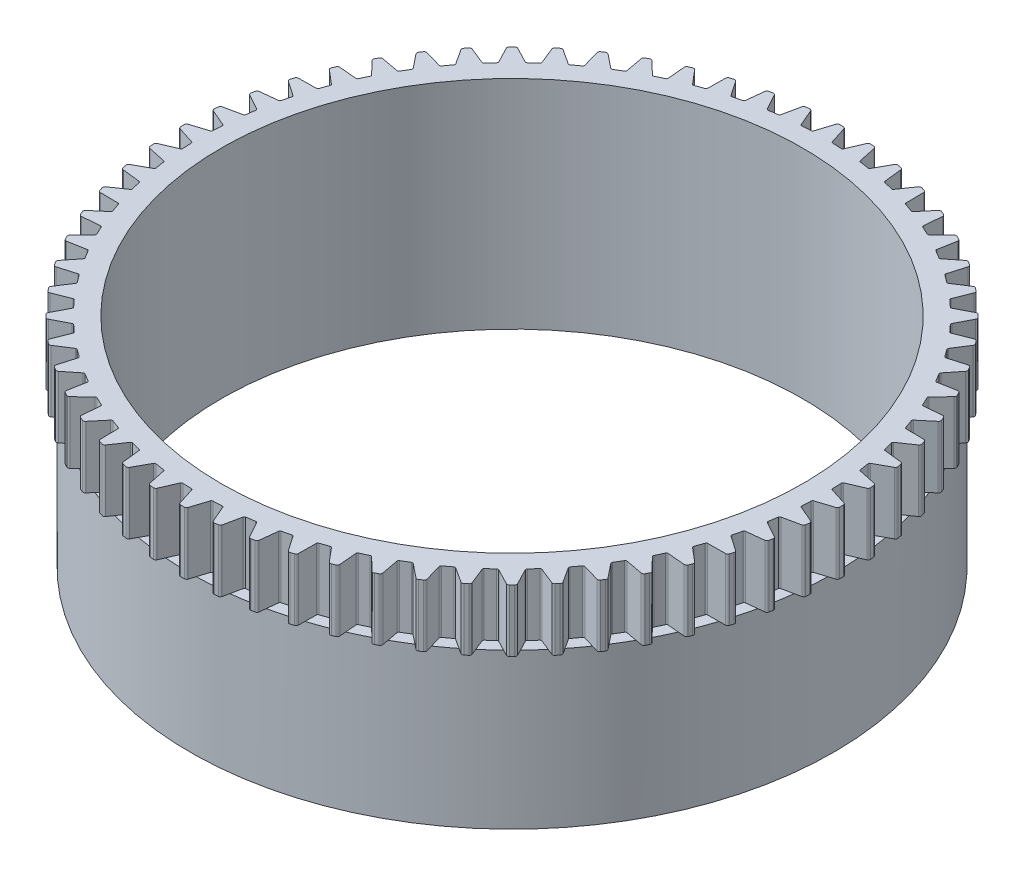
from build123d import *

# Parameters (mm, degrees)
BOSS_EXTRUDE1_DEPTH     = 8
SKETCH2_R               = 41.5
BOSS_EXTRUDE2_DEPTH     = 20
CUT_EXTRUDE1_DEPTH      = 67.306108316
CUT_EXTRUDE1_DEPTH_BACK = 67.306108316
SKETCH3_R               = 37.5


with BuildPart() as part:
    # Sketch1 → Boss-Extrude1 (new body)
    with BuildSketch(Plane(origin=(0, 0, 0), x_dir=(1, 0, 0), z_dir=(0, 1, 0))):
        with BuildLine():
            Line((-0.516428445, 42.290788925), (-1.207230425, 40.115163336))
            ThreePointArc((-1.207230425, 40.115163336), (-1.276964086, 40.016359136), (-1.390897576, 39.975810235))
            ThreePointArc((-1.390897576, 39.975810235), (-1.962706973, 39.951818248), (-2.534114577, 39.919647585))
            ThreePointArc((-2.534114577, 39.919647585), (-2.651473934, 39.948833797), (-2.730556314, 40.040327134))
            Line((-2.730556314, 40.040327134), (-3.631280492, 42.137766057))
            ThreePointArc((-3.631280492, 42.137766057), (-3.754372708, 42.277698039), (-3.936342379, 42.317943441))
            Line((-3.936342379, 42.317943441), (-4.395114549, 42.272758326))
            ThreePointArc((-4.395114549, 42.272758326), (-4.565736235, 42.197785707), (-4.659163894, 42.036528378))
            Line((-4.659163894, 42.036528378), (-5.133390874, 39.803668586))
            ThreePointArc((-5.133390874, 39.803668586), (-5.193104244, 39.698505061), (-5.302514626, 39.646983979))
            ThreePointArc((-5.302514626, 39.646983979), (-5.869218978, 39.567060399), (-6.434721822, 39.479036907))
            ThreePointArc((-6.434721822, 39.479036907), (-6.55437681, 39.49657935), (-6.642046302, 39.579880693))
            Line((-6.642046302, 39.579880693), (-7.744018213, 41.578933466))
            ThreePointArc((-7.744018213, 41.578933466), (-7.880233439, 41.706126491), (-8.065271615, 41.728341953))
            Line((-8.065271615, 41.728341953), (-8.517405756, 41.638406881))
            ThreePointArc((-8.517405756, 41.638406881), (-8.679857251, 41.547071426), (-8.757029047, 41.377433083))
            Line((-8.757029047, 41.377433083), (-9.010113964, 39.108842749))
            ThreePointArc((-9.010113964, 39.108842749), (-9.059231969, 38.998332681), (-9.163065561, 38.936335594))
            ThreePointArc((-9.163065561, 38.936335594), (-9.719207196, 38.801250128), (-10.273359178, 38.658221521))
            ThreePointArc((-10.273359178, 38.658221521), (-10.394157455, 38.663951254), (-10.489569754, 38.738258365))
            Line((-10.489569754, 38.738258365), (-11.782176804, 40.619673017))
            ThreePointArc((-11.782176804, 40.619673017), (-11.930203214, 40.732902146), (-12.116527877, 40.736873722))
            Line((-12.116527877, 40.736873722), (-12.55766969, 40.603054816))
            ThreePointArc((-12.55766969, 40.603054816), (-12.710386496, 40.496236135), (-12.770559223, 40.319850488))
            Line((-12.770559223, 40.319850488), (-12.80006473, 38.037377376))
            ThreePointArc((-12.80006473, 38.037377376), (-12.838114338, 37.922585038), (-12.935371166, 37.850709013))
            ThreePointArc((-12.935371166, 37.850709013), (-13.475594136, 37.661762607), (-14.01305847, 37.46510633))
            ThreePointArc((-14.01305847, 37.46510633), (-14.133836682, 37.458968171), (-14.236072915, 37.523565432))
            Line((-14.236072915, 37.523565432), (-15.706866593, 39.269222912))
            ThreePointArc((-15.706866593, 39.269222912), (-15.86527861, 39.367397686), (-16.051095352, 39.353087127))
            Line((-16.051095352, 39.353087127), (-16.476996399, 39.176673137))
            ThreePointArc((-16.476996399, 39.176673137), (-16.618507771, 39.055399952), (-16.661101934, 38.873965692))
            Line((-16.661101934, 38.873965692), (-16.466743876, 36.599591267))
            ThreePointArc((-16.466743876, 36.599591267), (-16.493358648, 36.481622172), (-16.583102075, 36.400559413))
            ThreePointArc((-16.583102075, 36.400559413), (-17.102203737, 36.159571725), (-17.617804348, 35.911181684))
            ThreePointArc((-17.617804348, 35.911181684), (-17.737399335, 35.893234747), (-17.845474911, 35.947500052))
            Line((-17.845474911, 35.947500052), (-19.48029067, 37.540588723))
            ThreePointArc((-19.48029067, 37.540588723), (-19.647562701, 37.622763666), (-19.831082004, 37.59030879))
            Line((-19.831082004, 37.59030879), (-20.237640627, 37.372998679))
            ThreePointArc((-20.237640627, 37.372998679), (-20.366583731, 37.238438918), (-20.391189124, 37.053703355))
            Line((-20.391189124, 37.053703355), (-19.974839276, 34.809331086))
            ThreePointArc((-19.974839276, 34.809331086), (-19.989762898, 34.68932134), (-20.071128646, 34.599852527))
            ThreePointArc((-20.071128646, 34.599852527), (-20.564109768, 34.3091444), (-21.052881139, 34.011412728))
            ThreePointArc((-21.052881139, 34.011412728), (-21.170141136, 33.981829851), (-21.283015229, 34.025240595))
            Line((-21.283015229, 34.025240595), (-23.066108899, 35.450418143))
            ThreePointArc((-23.066108899, 35.450418143), (-23.240630022, 35.515801865), (-23.420084495, 35.465515232))
            Line((-23.420084495, 35.465515232), (-23.803385311, 35.209401814))
            ThreePointArc((-23.803385311, 35.209401814), (-23.918518357, 35.062851361), (-23.924898017, 34.8765936))
            Line((-23.924898017, 34.8765936), (-23.290566055, 32.683838018))
            ThreePointArc((-23.290566055, 32.683838018), (-23.293654803, 32.562943381), (-23.365859276, 32.465930147))
            ThreePointArc((-23.365859276, 32.465930147), (-23.82797218, 32.128301259), (-24.285207176, 31.784095274))
            ThreePointArc((-24.285207176, 31.784095274), (-24.399002905, 31.743161358), (-24.515588475, 31.775299471))
            Line((-24.515588475, 31.775299471), (-26.42978789, 33.018840657))
            ThreePointArc((-26.42978789, 33.018840657), (-26.609877371, 33.066803477), (-26.78353877, 32.999169373))
            Line((-26.78353877, 32.999169373), (-27.139890384, 32.706719162))
            ThreePointArc((-27.139890384, 32.706719162), (-27.240104575, 32.549589378), (-27.228197062, 32.363603183))
            Line((-27.228197062, 32.363603183), (-26.381991951, 30.243581723))
            ThreePointArc((-26.381991951, 30.243581723), (-26.37321608, 30.122966477), (-26.435563908, 30.019343112))
            ThreePointArc((-26.435563908, 30.019343112), (-26.862358194, 29.638045014), (-27.283653392, 29.250679609))
            ThreePointArc((-27.283653392, 29.250679609), (-27.392888939, 29.198788868), (-27.512063203, 29.219344843))
            Line((-27.512063203, 29.219344843), (-29.538933575, 30.269273686))
            ThreePointArc((-29.538933575, 30.269273686), (-29.722857055, 30.299353696), (-29.889052926, 30.215023475))
            Line((-29.889052926, 30.215023475), (-30.215023475, 29.889052926))
            ThreePointArc((-30.215023475, 29.889052926), (-30.299353696, 29.722857055), (-30.269273686, 29.538933575))
            Line((-30.269273686, 29.538933575), (-29.219344843, 27.512063203))
            ThreePointArc((-29.219344843, 27.512063203), (-29.198788868, 27.392888939), (-29.250679609, 27.283653392))
            ThreePointArc((-29.250679609, 27.283653392), (-29.638045014, 26.862358194), (-30.019343112, 26.435563908))
            ThreePointArc((-30.019343112, 26.435563908), (-30.122966477, 26.37321608), (-30.243581723, 26.381991951))
            Line((-30.243581723, 26.381991951), (-32.363603183, 27.228197062))
            ThreePointArc((-32.363603183, 27.228197062), (-32.549589378, 27.240104575), (-32.706719162, 27.139890384))
            Line((-32.706719162, 27.139890384), (-32.999169373, 26.78353877))
            ThreePointArc((-32.999169373, 26.78353877), (-33.066803477, 26.609877371), (-33.018840657, 26.42978789))
            Line((-33.018840657, 26.42978789), (-31.775299471, 24.515588475))
            ThreePointArc((-31.775299471, 24.515588475), (-31.743161358, 24.399002905), (-31.784095274, 24.285207176))
            ThreePointArc((-31.784095274, 24.285207176), (-32.128301259, 23.82797218), (-32.465930147, 23.365859276))
            ThreePointArc((-32.465930147, 23.365859276), (-32.562943381, 23.293654803), (-32.683838018, 23.290566055))
            Line((-32.683838018, 23.290566055), (-34.8765936, 23.924898017))
            ThreePointArc((-34.8765936, 23.924898017), (-35.062851361, 23.918518357), (-35.209401814, 23.803385311))
            Line((-35.209401814, 23.803385311), (-35.465515232, 23.420084495))
            ThreePointArc((-35.465515232, 23.420084495), (-35.515801865, 23.240630022), (-35.450418143, 23.066108899))
            Line((-35.450418143, 23.066108899), (-34.025240595, 21.283015229))
            ThreePointArc((-34.025240595, 21.283015229), (-33.981829851, 21.170141136), (-34.011412728, 21.052881139))
            ThreePointArc((-34.011412728, 21.052881139), (-34.3091444, 20.564109768), (-34.599852527, 20.071128646))
            ThreePointArc((-34.599852527, 20.071128646), (-34.68932134, 19.989762898), (-34.809331086, 19.974839276))
            Line((-34.809331086, 19.974839276), (-37.053703355, 20.391189124))
            ThreePointArc((-37.053703355, 20.391189124), (-37.238438918, 20.366583731), (-37.372998679, 20.237640627))
            Line((-37.372998679, 20.237640627), (-37.59030879, 19.831082004))
            ThreePointArc((-37.59030879, 19.831082004), (-37.622763666, 19.647562701), (-37.540588723, 19.48029067))
            Line((-37.540588723, 19.48029067), (-35.947500052, 17.845474911))
            ThreePointArc((-35.947500052, 17.845474911), (-35.893234747, 17.737399335), (-35.911181684, 17.617804348))
            ThreePointArc((-35.911181684, 17.617804348), (-36.159571725, 17.102203737), (-36.400559413, 16.583102075))
            ThreePointArc((-36.400559413, 16.583102075), (-36.481622172, 16.493358648), (-36.599591267, 16.466743876))
            Line((-36.599591267, 16.466743876), (-38.873965692, 16.661101934))
            ThreePointArc((-38.873965692, 16.661101934), (-39.055399952, 16.618507771), (-39.176673137, 16.476996399))
            Line((-39.176673137, 16.476996399), (-39.353087127, 16.051095352))
            ThreePointArc((-39.353087127, 16.051095352), (-39.367397686, 15.86527861), (-39.269222912, 15.706866593))
            Line((-39.269222912, 15.706866593), (-37.523565432, 14.236072915))
            ThreePointArc((-37.523565432, 14.236072915), (-37.458968171, 14.133836682), (-37.46510633, 14.01305847))
            ThreePointArc((-37.46510633, 14.01305847), (-37.661762607, 13.475594136), (-37.850709013, 12.935371166))
            ThreePointArc((-37.850709013, 12.935371166), (-37.922585038, 12.838114338), (-38.037377376, 12.80006473))
            Line((-38.037377376, 12.80006473), (-40.319850488, 12.770559223))
            ThreePointArc((-40.319850488, 12.770559223), (-40.496236135, 12.710386496), (-40.603054816, 12.55766969))
            Line((-40.603054816, 12.55766969), (-40.736873722, 12.116527877))
            ThreePointArc((-40.736873722, 12.116527877), (-40.732902146, 11.930203214), (-40.619673017, 11.782176804))
            Line((-40.619673017, 11.782176804), (-38.738258365, 10.489569754))
            ThreePointArc((-38.738258365, 10.489569754), (-38.663951254, 10.394157455), (-38.658221521, 10.273359178))
            ThreePointArc((-38.658221521, 10.273359178), (-38.801250128, 9.719207196), (-38.936335594, 9.163065561))
            ThreePointArc((-38.936335594, 9.163065561), (-38.998332681, 9.059231969), (-39.108842749, 9.010113964))
            Line((-39.108842749, 9.010113964), (-41.377433083, 8.757029047))
            ThreePointArc((-41.377433083, 8.757029047), (-41.547071426, 8.679857251), (-41.638406881, 8.517405756))
            Line((-41.638406881, 8.517405756), (-41.728341953, 8.065271615))
            ThreePointArc((-41.728341953, 8.065271615), (-41.706126491, 7.880233439), (-41.578933466, 7.744018213))
            Line((-41.578933466, 7.744018213), (-39.579880693, 6.642046302))
            ThreePointArc((-39.579880693, 6.642046302), (-39.49657935, 6.55437681), (-39.479036907, 6.434721822))
            ThreePointArc((-39.479036907, 6.434721822), (-39.567060399, 5.869218978), (-39.646983979, 5.302514626))
            ThreePointArc((-39.646983979, 5.302514626), (-39.698505061, 5.193104244), (-39.803668586, 5.133390874))
            Line((-39.803668586, 5.133390874), (-42.036528378, 4.659163894))
            ThreePointArc((-42.036528378, 4.659163894), (-42.197785707, 4.565736235), (-42.272758326, 4.395114549))
            Line((-42.272758326, 4.395114549), (-42.317943441, 3.936342379))
            ThreePointArc((-42.317943441, 3.936342379), (-42.277698039, 3.754372708), (-42.137766057, 3.631280492))
            Line((-42.137766057, 3.631280492), (-40.040327134, 2.730556314))
            ThreePointArc((-40.040327134, 2.730556314), (-39.948833797, 2.651473934), (-39.919647585, 2.534114577))
            ThreePointArc((-39.919647585, 2.534114577), (-39.951818248, 1.962706973), (-39.975810235, 1.390897576))
            ThreePointArc((-39.975810235, 1.390897576), (-40.016359136, 1.276964086), (-40.115163336, 1.207230425))
            Line((-40.115163336, 1.207230425), (-42.290788925, 0.516428445))
            ThreePointArc((-42.290788925, 0.516428445), (-42.442112244, 0.407644684), (-42.5, 0.230495986))
            Line((-42.5, 0.230495986), (-42.5, -0.230495986))
            ThreePointArc((-42.5, -0.230495986), (-42.442112244, -0.407644684), (-42.290788925, -0.516428445))
            Line((-42.290788925, -0.516428445), (-40.115163336, -1.207230425))
            ThreePointArc((-40.115163336, -1.207230425), (-40.016359136, -1.276964086), (-39.975810235, -1.390897576))
            ThreePointArc((-39.975810235, -1.390897576), (-39.951818248, -1.962706973), (-39.919647585, -2.534114577))
            ThreePointArc((-39.919647585, -2.534114577), (-39.948833797, -2.651473934), (-40.040327134, -2.730556314))
            Line((-40.040327134, -2.730556314), (-42.137766057, -3.631280492))
            ThreePointArc((-42.137766057, -3.631280492), (-42.277698039, -3.754372708), (-42.317943441, -3.936342379))
            Line((-42.317943441, -3.936342379), (-42.272758326, -4.395114549))
            ThreePointArc((-42.272758326, -4.395114549), (-42.197785707, -4.565736235), (-42.036528378, -4.659163894))
            Line((-42.036528378, -4.659163894), (-39.803668586, -5.133390874))
            ThreePointArc((-39.803668586, -5.133390874), (-39.698505061, -5.193104244), (-39.646983979, -5.302514626))
            ThreePointArc((-39.646983979, -5.302514626), (-39.567060399, -5.869218978), (-39.479036907, -6.434721822))
            ThreePointArc((-39.479036907, -6.434721822), (-39.49657935, -6.55437681), (-39.579880693, -6.642046302))
            Line((-39.579880693, -6.642046302), (-41.578933466, -7.744018213))
            ThreePointArc((-41.578933466, -7.744018213), (-41.706126491, -7.880233439), (-41.728341953, -8.065271615))
            Line((-41.728341953, -8.065271615), (-41.638406881, -8.517405756))
            ThreePointArc((-41.638406881, -8.517405756), (-41.547071426, -8.679857251), (-41.377433083, -8.757029047))
            Line((-41.377433083, -8.757029047), (-39.108842749, -9.010113964))
            ThreePointArc((-39.108842749, -9.010113964), (-38.998332681, -9.059231969), (-38.936335594, -9.163065561))
            ThreePointArc((-38.936335594, -9.163065561), (-38.801250128, -9.719207196), (-38.658221521, -10.273359178))
            ThreePointArc((-38.658221521, -10.273359178), (-38.663951254, -10.394157455), (-38.738258365, -10.489569754))
            Line((-38.738258365, -10.489569754), (-40.619673017, -11.782176804))
            ThreePointArc((-40.619673017, -11.782176804), (-40.732902146, -11.930203214), (-40.736873722, -12.116527877))
            Line((-40.736873722, -12.116527877), (-40.603054816, -12.55766969))
            ThreePointArc((-40.603054816, -12.55766969), (-40.496236135, -12.710386496), (-40.319850488, -12.770559223))
            Line((-40.319850488, -12.770559223), (-38.037377376, -12.80006473))
            ThreePointArc((-38.037377376, -12.80006473), (-37.922585038, -12.838114338), (-37.850709013, -12.935371166))
            ThreePointArc((-37.850709013, -12.935371166), (-37.661762607, -13.475594136), (-37.46510633, -14.01305847))
            ThreePointArc((-37.46510633, -14.01305847), (-37.458968171, -14.133836682), (-37.523565432, -14.236072915))
            Line((-37.523565432, -14.236072915), (-39.269222912, -15.706866593))
            ThreePointArc((-39.269222912, -15.706866593), (-39.367397686, -15.86527861), (-39.353087127, -16.051095352))
            Line((-39.353087127, -16.051095352), (-39.176673137, -16.476996399))
            ThreePointArc((-39.176673137, -16.476996399), (-39.055399952, -16.618507771), (-38.873965692, -16.661101934))
            Line((-38.873965692, -16.661101934), (-36.599591267, -16.466743876))
            ThreePointArc((-36.599591267, -16.466743876), (-36.481622172, -16.493358648), (-36.400559413, -16.583102075))
            ThreePointArc((-36.400559413, -16.583102075), (-36.159571725, -17.102203737), (-35.911181684, -17.617804348))
            ThreePointArc((-35.911181684, -17.617804348), (-35.893234747, -17.737399335), (-35.947500052, -17.845474911))
            Line((-35.947500052, -17.845474911), (-37.540588723, -19.48029067))
            ThreePointArc((-37.540588723, -19.48029067), (-37.622763666, -19.647562701), (-37.59030879, -19.831082004))
            Line((-37.59030879, -19.831082004), (-37.372998679, -20.237640627))
            ThreePointArc((-37.372998679, -20.237640627), (-37.238438918, -20.366583731), (-37.053703355, -20.391189124))
            Line((-37.053703355, -20.391189124), (-34.809331086, -19.974839276))
            ThreePointArc((-34.809331086, -19.974839276), (-34.68932134, -19.989762898), (-34.599852527, -20.071128646))
            ThreePointArc((-34.599852527, -20.071128646), (-34.3091444, -20.564109768), (-34.011412728, -21.052881139))
            ThreePointArc((-34.011412728, -21.052881139), (-33.981829851, -21.170141136), (-34.025240595, -21.283015229))
            Line((-34.025240595, -21.283015229), (-35.450418143, -23.066108899))
            ThreePointArc((-35.450418143, -23.066108899), (-35.515801865, -23.240630022), (-35.465515232, -23.420084495))
            Line((-35.465515232, -23.420084495), (-35.209401814, -23.803385311))
            ThreePointArc((-35.209401814, -23.803385311), (-35.062851361, -23.918518357), (-34.8765936, -23.924898017))
            Line((-34.8765936, -23.924898017), (-32.683838018, -23.290566055))
            ThreePointArc((-32.683838018, -23.290566055), (-32.562943381, -23.293654803), (-32.465930147, -23.365859276))
            ThreePointArc((-32.465930147, -23.365859276), (-32.128301259, -23.82797218), (-31.784095274, -24.285207176))
            ThreePointArc((-31.784095274, -24.285207176), (-31.743161358, -24.399002905), (-31.775299471, -24.515588475))
            Line((-31.775299471, -24.515588475), (-33.018840657, -26.42978789))
            ThreePointArc((-33.018840657, -26.42978789), (-33.066803477, -26.609877371), (-32.999169373, -26.78353877))
            Line((-32.999169373, -26.78353877), (-32.706719162, -27.139890384))
            ThreePointArc((-32.706719162, -27.139890384), (-32.549589378, -27.240104575), (-32.363603183, -27.228197062))
            Line((-32.363603183, -27.228197062), (-30.243581723, -26.381991951))
            ThreePointArc((-30.243581723, -26.381991951), (-30.122966477, -26.37321608), (-30.019343112, -26.435563908))
            ThreePointArc((-30.019343112, -26.435563908), (-29.638045014, -26.862358194), (-29.250679609, -27.283653392))
            ThreePointArc((-29.250679609, -27.283653392), (-29.198788868, -27.392888939), (-29.219344843, -27.512063203))
            Line((-29.219344843, -27.512063203), (-30.269273686, -29.538933575))
            ThreePointArc((-30.269273686, -29.538933575), (-30.299353696, -29.722857055), (-30.215023475, -29.889052926))
            Line((-30.215023475, -29.889052926), (-29.889052926, -30.215023475))
            ThreePointArc((-29.889052926, -30.215023475), (-29.722857055, -30.299353696), (-29.538933575, -30.269273686))
            Line((-29.538933575, -30.269273686), (-27.512063203, -29.219344843))
            ThreePointArc((-27.512063203, -29.219344843), (-27.392888939, -29.198788868), (-27.283653392, -29.250679609))
            ThreePointArc((-27.283653392, -29.250679609), (-26.862358194, -29.638045014), (-26.435563908, -30.019343112))
            ThreePointArc((-26.435563908, -30.019343112), (-26.37321608, -30.122966477), (-26.381991951, -30.243581723))
            Line((-26.381991951, -30.243581723), (-27.228197062, -32.363603183))
            ThreePointArc((-27.228197062, -32.363603183), (-27.240104575, -32.549589378), (-27.139890384, -32.706719162))
            Line((-27.139890384, -32.706719162), (-26.78353877, -32.999169373))
            ThreePointArc((-26.78353877, -32.999169373), (-26.609877371, -33.066803477), (-26.42978789, -33.018840657))
            Line((-26.42978789, -33.018840657), (-24.515588475, -31.775299471))
            ThreePointArc((-24.515588475, -31.775299471), (-24.399002905, -31.743161358), (-24.285207176, -31.784095274))
            ThreePointArc((-24.285207176, -31.784095274), (-23.82797218, -32.128301259), (-23.365859276, -32.465930147))
            ThreePointArc((-23.365859276, -32.465930147), (-23.293654803, -32.562943381), (-23.290566055, -32.683838018))
            Line((-23.290566055, -32.683838018), (-23.924898017, -34.8765936))
            ThreePointArc((-23.924898017, -34.8765936), (-23.918518357, -35.062851361), (-23.803385311, -35.209401814))
            Line((-23.803385311, -35.209401814), (-23.420084495, -35.465515232))
            ThreePointArc((-23.420084495, -35.465515232), (-23.240630022, -35.515801865), (-23.066108899, -35.450418143))
            Line((-23.066108899, -35.450418143), (-21.283015229, -34.025240595))
            ThreePointArc((-21.283015229, -34.025240595), (-21.170141136, -33.981829851), (-21.052881139, -34.011412728))
            ThreePointArc((-21.052881139, -34.011412728), (-20.564109768, -34.3091444), (-20.071128646, -34.599852527))
            ThreePointArc((-20.071128646, -34.599852527), (-19.989762898, -34.68932134), (-19.974839276, -34.809331086))
            Line((-19.974839276, -34.809331086), (-20.391189124, -37.053703355))
            ThreePointArc((-20.391189124, -37.053703355), (-20.366583731, -37.238438918), (-20.237640627, -37.372998679))
            Line((-20.237640627, -37.372998679), (-19.831082004, -37.59030879))
            ThreePointArc((-19.831082004, -37.59030879), (-19.647562701, -37.622763666), (-19.48029067, -37.540588723))
            Line((-19.48029067, -37.540588723), (-17.845474911, -35.947500052))
            ThreePointArc((-17.845474911, -35.947500052), (-17.737399335, -35.893234747), (-17.617804348, -35.911181684))
            ThreePointArc((-17.617804348, -35.911181684), (-17.102203737, -36.159571725), (-16.583102075, -36.400559413))
            ThreePointArc((-16.583102075, -36.400559413), (-16.493358648, -36.481622172), (-16.466743876, -36.599591267))
            Line((-16.466743876, -36.599591267), (-16.661101934, -38.873965692))
            ThreePointArc((-16.661101934, -38.873965692), (-16.618507771, -39.055399952), (-16.476996399, -39.176673137))
            Line((-16.476996399, -39.176673137), (-16.051095352, -39.353087127))
            ThreePointArc((-16.051095352, -39.353087127), (-15.86527861, -39.367397686), (-15.706866593, -39.269222912))
            Line((-15.706866593, -39.269222912), (-14.236072915, -37.523565432))
            ThreePointArc((-14.236072915, -37.523565432), (-14.133836682, -37.458968171), (-14.01305847, -37.46510633))
            ThreePointArc((-14.01305847, -37.46510633), (-13.475594136, -37.661762607), (-12.935371166, -37.850709013))
            ThreePointArc((-12.935371166, -37.850709013), (-12.838114338, -37.922585038), (-12.80006473, -38.037377376))
            Line((-12.80006473, -38.037377376), (-12.770559223, -40.319850488))
            ThreePointArc((-12.770559223, -40.319850488), (-12.710386496, -40.496236135), (-12.55766969, -40.603054816))
            Line((-12.55766969, -40.603054816), (-12.116527877, -40.736873722))
            ThreePointArc((-12.116527877, -40.736873722), (-11.930203214, -40.732902146), (-11.782176804, -40.619673017))
            Line((-11.782176804, -40.619673017), (-10.489569754, -38.738258365))
            ThreePointArc((-10.489569754, -38.738258365), (-10.394157455, -38.663951254), (-10.273359178, -38.658221521))
            ThreePointArc((-10.273359178, -38.658221521), (-9.719207196, -38.801250128), (-9.163065561, -38.936335594))
            ThreePointArc((-9.163065561, -38.936335594), (-9.059231969, -38.998332681), (-9.010113964, -39.108842749))
            Line((-9.010113964, -39.108842749), (-8.757029047, -41.377433083))
            ThreePointArc((-8.757029047, -41.377433083), (-8.679857251, -41.547071426), (-8.517405756, -41.638406881))
            Line((-8.517405756, -41.638406881), (-8.065271615, -41.728341953))
            ThreePointArc((-8.065271615, -41.728341953), (-7.880233439, -41.706126491), (-7.744018213, -41.578933466))
            Line((-7.744018213, -41.578933466), (-6.642046302, -39.579880693))
            ThreePointArc((-6.642046302, -39.579880693), (-6.55437681, -39.49657935), (-6.434721822, -39.479036907))
            ThreePointArc((-6.434721822, -39.479036907), (-5.869218978, -39.567060399), (-5.302514626, -39.646983979))
            ThreePointArc((-5.302514626, -39.646983979), (-5.193104244, -39.698505061), (-5.133390874, -39.803668586))
            Line((-5.133390874, -39.803668586), (-4.659163894, -42.036528378))
            ThreePointArc((-4.659163894, -42.036528378), (-4.565736235, -42.197785707), (-4.395114549, -42.272758326))
            Line((-4.395114549, -42.272758326), (-3.936342379, -42.317943441))
            ThreePointArc((-3.936342379, -42.317943441), (-3.754372708, -42.277698039), (-3.631280492, -42.137766057))
            Line((-3.631280492, -42.137766057), (-2.730556314, -40.040327134))
            ThreePointArc((-2.730556314, -40.040327134), (-2.651473934, -39.948833797), (-2.534114577, -39.919647585))
            ThreePointArc((-2.534114577, -39.919647585), (-1.962706973, -39.951818248), (-1.390897576, -39.975810235))
            ThreePointArc((-1.390897576, -39.975810235), (-1.276964086, -40.016359136), (-1.207230425, -40.115163336))
            Line((-1.207230425, -40.115163336), (-0.516428445, -42.290788925))
            ThreePointArc((-0.516428445, -42.290788925), (-0.407644684, -42.442112244), (-0.230495986, -42.5))
            Line((-0.230495986, -42.5), (0.230495986, -42.5))
            ThreePointArc((0.230495986, -42.5), (0.407644684, -42.442112244), (0.516428445, -42.290788925))
            Line((0.516428445, -42.290788925), (1.207230425, -40.115163336))
            ThreePointArc((1.207230425, -40.115163336), (1.276964086, -40.016359136), (1.390897576, -39.975810235))
            ThreePointArc((1.390897576, -39.975810235), (1.962706973, -39.951818248), (2.534114577, -39.919647585))
            ThreePointArc((2.534114577, -39.919647585), (2.651473934, -39.948833797), (2.730556314, -40.040327134))
            Line((2.730556314, -40.040327134), (3.631280492, -42.137766057))
            ThreePointArc((3.631280492, -42.137766057), (3.754372708, -42.277698039), (3.936342379, -42.317943441))
            Line((3.936342379, -42.317943441), (4.395114549, -42.272758326))
            ThreePointArc((4.395114549, -42.272758326), (4.565736235, -42.197785707), (4.659163894, -42.036528378))
            Line((4.659163894, -42.036528378), (5.133390874, -39.803668586))
            ThreePointArc((5.133390874, -39.803668586), (5.193104244, -39.698505061), (5.302514626, -39.646983979))
            ThreePointArc((5.302514626, -39.646983979), (5.869218978, -39.567060399), (6.434721822, -39.479036907))
            ThreePointArc((6.434721822, -39.479036907), (6.55437681, -39.49657935), (6.642046302, -39.579880693))
            Line((6.642046302, -39.579880693), (7.744018213, -41.578933466))
            ThreePointArc((7.744018213, -41.578933466), (7.880233439, -41.706126491), (8.065271615, -41.728341953))
            Line((8.065271615, -41.728341953), (8.517405756, -41.638406881))
            ThreePointArc((8.517405756, -41.638406881), (8.679857251, -41.547071426), (8.757029047, -41.377433083))
            Line((8.757029047, -41.377433083), (9.010113964, -39.108842749))
            ThreePointArc((9.010113964, -39.108842749), (9.059231969, -38.998332681), (9.163065561, -38.936335594))
            ThreePointArc((9.163065561, -38.936335594), (9.719207196, -38.801250128), (10.273359178, -38.658221521))
            ThreePointArc((10.273359178, -38.658221521), (10.394157455, -38.663951254), (10.489569754, -38.738258365))
            Line((10.489569754, -38.738258365), (11.782176804, -40.619673017))
            ThreePointArc((11.782176804, -40.619673017), (11.930203214, -40.732902146), (12.116527877, -40.736873722))
            Line((12.116527877, -40.736873722), (12.55766969, -40.603054816))
            ThreePointArc((12.55766969, -40.603054816), (12.710386496, -40.496236135), (12.770559223, -40.319850488))
            Line((12.770559223, -40.319850488), (12.80006473, -38.037377376))
            ThreePointArc((12.80006473, -38.037377376), (12.838114338, -37.922585038), (12.935371166, -37.850709013))
            ThreePointArc((12.935371166, -37.850709013), (13.475594136, -37.661762607), (14.01305847, -37.46510633))
            ThreePointArc((14.01305847, -37.46510633), (14.133836682, -37.458968171), (14.236072915, -37.523565432))
            Line((14.236072915, -37.523565432), (15.706866593, -39.269222912))
            ThreePointArc((15.706866593, -39.269222912), (15.86527861, -39.367397686), (16.051095352, -39.353087127))
            Line((16.051095352, -39.353087127), (16.476996399, -39.176673137))
            ThreePointArc((16.476996399, -39.176673137), (16.618507771, -39.055399952), (16.661101934, -38.873965692))
            Line((16.661101934, -38.873965692), (16.466743876, -36.599591267))
            ThreePointArc((16.466743876, -36.599591267), (16.493358648, -36.481622172), (16.583102075, -36.400559413))
            ThreePointArc((16.583102075, -36.400559413), (17.102203737, -36.159571725), (17.617804348, -35.911181684))
            ThreePointArc((17.617804348, -35.911181684), (17.737399335, -35.893234747), (17.845474911, -35.947500052))
            Line((17.845474911, -35.947500052), (19.48029067, -37.540588723))
            ThreePointArc((19.48029067, -37.540588723), (19.647562701, -37.622763666), (19.831082004, -37.59030879))
            Line((19.831082004, -37.59030879), (20.237640627, -37.372998679))
            ThreePointArc((20.237640627, -37.372998679), (20.366583731, -37.238438918), (20.391189124, -37.053703355))
            Line((20.391189124, -37.053703355), (19.974839276, -34.809331086))
            ThreePointArc((19.974839276, -34.809331086), (19.989762898, -34.68932134), (20.071128646, -34.599852527))
            ThreePointArc((20.071128646, -34.599852527), (20.564109768, -34.3091444), (21.052881139, -34.011412728))
            ThreePointArc((21.052881139, -34.011412728), (21.170141136, -33.981829851), (21.283015229, -34.025240595))
            Line((21.283015229, -34.025240595), (23.066108899, -35.450418143))
            ThreePointArc((23.066108899, -35.450418143), (23.240630022, -35.515801865), (23.420084495, -35.465515232))
            Line((23.420084495, -35.465515232), (23.803385311, -35.209401814))
            ThreePointArc((23.803385311, -35.209401814), (23.918518357, -35.062851361), (23.924898017, -34.8765936))
            Line((23.924898017, -34.8765936), (23.290566055, -32.683838018))
            ThreePointArc((23.290566055, -32.683838018), (23.293654803, -32.562943381), (23.365859276, -32.465930147))
            ThreePointArc((23.365859276, -32.465930147), (23.82797218, -32.128301259), (24.285207176, -31.784095274))
            ThreePointArc((24.285207176, -31.784095274), (24.399002905, -31.743161358), (24.515588475, -31.775299471))
            Line((24.515588475, -31.775299471), (26.42978789, -33.018840657))
            ThreePointArc((26.42978789, -33.018840657), (26.609877371, -33.066803477), (26.78353877, -32.999169373))
            Line((26.78353877, -32.999169373), (27.139890384, -32.706719162))
            ThreePointArc((27.139890384, -32.706719162), (27.240104575, -32.549589378), (27.228197062, -32.363603183))
            Line((27.228197062, -32.363603183), (26.381991951, -30.243581723))
            ThreePointArc((26.381991951, -30.243581723), (26.37321608, -30.122966477), (26.435563908, -30.019343112))
            ThreePointArc((26.435563908, -30.019343112), (26.862358194, -29.638045014), (27.283653392, -29.250679609))
            ThreePointArc((27.283653392, -29.250679609), (27.392888939, -29.198788868), (27.512063203, -29.219344843))
            Line((27.512063203, -29.219344843), (29.538933575, -30.269273686))
            ThreePointArc((29.538933575, -30.269273686), (29.722857055, -30.299353696), (29.889052926, -30.215023475))
            Line((29.889052926, -30.215023475), (30.215023475, -29.889052926))
            ThreePointArc((30.215023475, -29.889052926), (30.299353696, -29.722857055), (30.269273686, -29.538933575))
            Line((30.269273686, -29.538933575), (29.219344843, -27.512063203))
            ThreePointArc((29.219344843, -27.512063203), (29.198788868, -27.392888939), (29.250679609, -27.283653392))
            ThreePointArc((29.250679609, -27.283653392), (29.638045014, -26.862358194), (30.019343112, -26.435563908))
            ThreePointArc((30.019343112, -26.435563908), (30.122966477, -26.37321608), (30.243581723, -26.381991951))
            Line((30.243581723, -26.381991951), (32.363603183, -27.228197062))
            ThreePointArc((32.363603183, -27.228197062), (32.549589378, -27.240104575), (32.706719162, -27.139890384))
            Line((32.706719162, -27.139890384), (32.999169373, -26.78353877))
            ThreePointArc((32.999169373, -26.78353877), (33.066803477, -26.609877371), (33.018840657, -26.42978789))
            Line((33.018840657, -26.42978789), (31.775299471, -24.515588475))
            ThreePointArc((31.775299471, -24.515588475), (31.743161358, -24.399002905), (31.784095274, -24.285207176))
            ThreePointArc((31.784095274, -24.285207176), (32.128301259, -23.82797218), (32.465930147, -23.365859276))
            ThreePointArc((32.465930147, -23.365859276), (32.562943381, -23.293654803), (32.683838018, -23.290566055))
            Line((32.683838018, -23.290566055), (34.8765936, -23.924898017))
            ThreePointArc((34.8765936, -23.924898017), (35.062851361, -23.918518357), (35.209401814, -23.803385311))
            Line((35.209401814, -23.803385311), (35.465515232, -23.420084495))
            ThreePointArc((35.465515232, -23.420084495), (35.515801865, -23.240630022), (35.450418143, -23.066108899))
            Line((35.450418143, -23.066108899), (34.025240595, -21.283015229))
            ThreePointArc((34.025240595, -21.283015229), (33.981829851, -21.170141136), (34.011412728, -21.052881139))
            ThreePointArc((34.011412728, -21.052881139), (34.3091444, -20.564109768), (34.599852527, -20.071128646))
            ThreePointArc((34.599852527, -20.071128646), (34.68932134, -19.989762898), (34.809331086, -19.974839276))
            Line((34.809331086, -19.974839276), (37.053703355, -20.391189124))
            ThreePointArc((37.053703355, -20.391189124), (37.238438918, -20.366583731), (37.372998679, -20.237640627))
            Line((37.372998679, -20.237640627), (37.59030879, -19.831082004))
            ThreePointArc((37.59030879, -19.831082004), (37.622763666, -19.647562701), (37.540588723, -19.48029067))
            Line((37.540588723, -19.48029067), (35.947500052, -17.845474911))
            ThreePointArc((35.947500052, -17.845474911), (35.893234747, -17.737399335), (35.911181684, -17.617804348))
            ThreePointArc((35.911181684, -17.617804348), (36.159571725, -17.102203737), (36.400559413, -16.583102075))
            ThreePointArc((36.400559413, -16.583102075), (36.481622172, -16.493358648), (36.599591267, -16.466743876))
            Line((36.599591267, -16.466743876), (38.873965692, -16.661101934))
            ThreePointArc((38.873965692, -16.661101934), (39.055399952, -16.618507771), (39.176673137, -16.476996399))
            Line((39.176673137, -16.476996399), (39.353087127, -16.051095352))
            ThreePointArc((39.353087127, -16.051095352), (39.367397686, -15.86527861), (39.269222912, -15.706866593))
            Line((39.269222912, -15.706866593), (37.523565432, -14.236072915))
            ThreePointArc((37.523565432, -14.236072915), (37.458968171, -14.133836682), (37.46510633, -14.01305847))
            ThreePointArc((37.46510633, -14.01305847), (37.661762607, -13.475594136), (37.850709013, -12.935371166))
            ThreePointArc((37.850709013, -12.935371166), (37.922585038, -12.838114338), (38.037377376, -12.80006473))
            Line((38.037377376, -12.80006473), (40.319850488, -12.770559223))
            ThreePointArc((40.319850488, -12.770559223), (40.496236135, -12.710386496), (40.603054816, -12.55766969))
            Line((40.603054816, -12.55766969), (40.736873722, -12.116527877))
            ThreePointArc((40.736873722, -12.116527877), (40.732902146, -11.930203214), (40.619673017, -11.782176804))
            Line((40.619673017, -11.782176804), (38.738258365, -10.489569754))
            ThreePointArc((38.738258365, -10.489569754), (38.663951254, -10.394157455), (38.658221521, -10.273359178))
            ThreePointArc((38.658221521, -10.273359178), (38.801250128, -9.719207196), (38.936335594, -9.163065561))
            ThreePointArc((38.936335594, -9.163065561), (38.998332681, -9.059231969), (39.108842749, -9.010113964))
            Line((39.108842749, -9.010113964), (41.377433083, -8.757029047))
            ThreePointArc((41.377433083, -8.757029047), (41.547071426, -8.679857251), (41.638406881, -8.517405756))
            Line((41.638406881, -8.517405756), (41.728341953, -8.065271615))
            ThreePointArc((41.728341953, -8.065271615), (41.706126491, -7.880233439), (41.578933466, -7.744018213))
            Line((41.578933466, -7.744018213), (39.579880693, -6.642046302))
            ThreePointArc((39.579880693, -6.642046302), (39.49657935, -6.55437681), (39.479036907, -6.434721822))
            ThreePointArc((39.479036907, -6.434721822), (39.567060399, -5.869218978), (39.646983979, -5.302514626))
            ThreePointArc((39.646983979, -5.302514626), (39.698505061, -5.193104244), (39.803668586, -5.133390874))
            Line((39.803668586, -5.133390874), (42.036528378, -4.659163894))
            ThreePointArc((42.036528378, -4.659163894), (42.197785707, -4.565736235), (42.272758326, -4.395114549))
            Line((42.272758326, -4.395114549), (42.317943441, -3.936342379))
            ThreePointArc((42.317943441, -3.936342379), (42.277698039, -3.754372708), (42.137766057, -3.631280492))
            Line((42.137766057, -3.631280492), (40.040327134, -2.730556314))
            ThreePointArc((40.040327134, -2.730556314), (39.948833797, -2.651473934), (39.919647585, -2.534114577))
            ThreePointArc((39.919647585, -2.534114577), (39.951818248, -1.962706973), (39.975810235, -1.390897576))
            ThreePointArc((39.975810235, -1.390897576), (40.016359136, -1.276964086), (40.115163336, -1.207230425))
            Line((40.115163336, -1.207230425), (42.290788925, -0.516428445))
            ThreePointArc((42.290788925, -0.516428445), (42.442112244, -0.407644684), (42.5, -0.230495986))
            Line((42.5, -0.230495986), (42.5, 0.230495986))
            ThreePointArc((42.5, 0.230495986), (42.442112244, 0.407644684), (42.290788925, 0.516428445))
            Line((42.290788925, 0.516428445), (40.115163336, 1.207230425))
            ThreePointArc((40.115163336, 1.207230425), (40.016359136, 1.276964086), (39.975810235, 1.390897576))
            ThreePointArc((39.975810235, 1.390897576), (39.951818248, 1.962706973), (39.919647585, 2.534114577))
            ThreePointArc((39.919647585, 2.534114577), (39.948833797, 2.651473934), (40.040327134, 2.730556314))
            Line((40.040327134, 2.730556314), (42.137766057, 3.631280492))
            ThreePointArc((42.137766057, 3.631280492), (42.277698039, 3.754372708), (42.317943441, 3.936342379))
            Line((42.317943441, 3.936342379), (42.272758326, 4.395114549))
            ThreePointArc((42.272758326, 4.395114549), (42.197785707, 4.565736235), (42.036528378, 4.659163894))
            Line((42.036528378, 4.659163894), (39.803668586, 5.133390874))
            ThreePointArc((39.803668586, 5.133390874), (39.698505061, 5.193104244), (39.646983979, 5.302514626))
            ThreePointArc((39.646983979, 5.302514626), (39.567060399, 5.869218978), (39.479036907, 6.434721822))
            ThreePointArc((39.479036907, 6.434721822), (39.49657935, 6.55437681), (39.579880693, 6.642046302))
            Line((39.579880693, 6.642046302), (41.578933466, 7.744018213))
            ThreePointArc((41.578933466, 7.744018213), (41.706126491, 7.880233439), (41.728341953, 8.065271615))
            Line((41.728341953, 8.065271615), (41.638406881, 8.517405756))
            ThreePointArc((41.638406881, 8.517405756), (41.547071426, 8.679857251), (41.377433083, 8.757029047))
            Line((41.377433083, 8.757029047), (39.108842749, 9.010113964))
            ThreePointArc((39.108842749, 9.010113964), (38.998332681, 9.059231969), (38.936335594, 9.163065561))
            ThreePointArc((38.936335594, 9.163065561), (38.801250128, 9.719207196), (38.658221521, 10.273359178))
            ThreePointArc((38.658221521, 10.273359178), (38.663951254, 10.394157455), (38.738258365, 10.489569754))
            Line((38.738258365, 10.489569754), (40.619673017, 11.782176804))
            ThreePointArc((40.619673017, 11.782176804), (40.732902146, 11.930203214), (40.736873722, 12.116527877))
            Line((40.736873722, 12.116527877), (40.603054816, 12.55766969))
            ThreePointArc((40.603054816, 12.55766969), (40.496236135, 12.710386496), (40.319850488, 12.770559223))
            Line((40.319850488, 12.770559223), (38.037377376, 12.80006473))
            ThreePointArc((38.037377376, 12.80006473), (37.922585038, 12.838114338), (37.850709013, 12.935371166))
            ThreePointArc((37.850709013, 12.935371166), (37.661762607, 13.475594136), (37.46510633, 14.01305847))
            ThreePointArc((37.46510633, 14.01305847), (37.458968171, 14.133836682), (37.523565432, 14.236072915))
            Line((37.523565432, 14.236072915), (39.269222912, 15.706866593))
            ThreePointArc((39.269222912, 15.706866593), (39.367397686, 15.86527861), (39.353087127, 16.051095352))
            Line((39.353087127, 16.051095352), (39.176673137, 16.476996399))
            ThreePointArc((39.176673137, 16.476996399), (39.055399952, 16.618507771), (38.873965692, 16.661101934))
            Line((38.873965692, 16.661101934), (36.599591267, 16.466743876))
            ThreePointArc((36.599591267, 16.466743876), (36.481622172, 16.493358648), (36.400559413, 16.583102075))
            ThreePointArc((36.400559413, 16.583102075), (36.159571725, 17.102203737), (35.911181684, 17.617804348))
            ThreePointArc((35.911181684, 17.617804348), (35.893234747, 17.737399335), (35.947500052, 17.845474911))
            Line((35.947500052, 17.845474911), (37.540588723, 19.48029067))
            ThreePointArc((37.540588723, 19.48029067), (37.622763666, 19.647562701), (37.59030879, 19.831082004))
            Line((37.59030879, 19.831082004), (37.372998679, 20.237640627))
            ThreePointArc((37.372998679, 20.237640627), (37.238438918, 20.366583731), (37.053703355, 20.391189124))
            Line((37.053703355, 20.391189124), (34.809331086, 19.974839276))
            ThreePointArc((34.809331086, 19.974839276), (34.68932134, 19.989762898), (34.599852527, 20.071128646))
            ThreePointArc((34.599852527, 20.071128646), (34.3091444, 20.564109768), (34.011412728, 21.052881139))
            ThreePointArc((34.011412728, 21.052881139), (33.981829851, 21.170141136), (34.025240595, 21.283015229))
            Line((34.025240595, 21.283015229), (35.450418143, 23.066108899))
            ThreePointArc((35.450418143, 23.066108899), (35.515801865, 23.240630022), (35.465515232, 23.420084495))
            Line((35.465515232, 23.420084495), (35.209401814, 23.803385311))
            ThreePointArc((35.209401814, 23.803385311), (35.062851361, 23.918518357), (34.8765936, 23.924898017))
            Line((34.8765936, 23.924898017), (32.683838018, 23.290566055))
            ThreePointArc((32.683838018, 23.290566055), (32.562943381, 23.293654803), (32.465930147, 23.365859276))
            ThreePointArc((32.465930147, 23.365859276), (32.128301259, 23.82797218), (31.784095274, 24.285207176))
            ThreePointArc((31.784095274, 24.285207176), (31.743161358, 24.399002905), (31.775299471, 24.515588475))
            Line((31.775299471, 24.515588475), (33.018840657, 26.42978789))
            ThreePointArc((33.018840657, 26.42978789), (33.066803477, 26.609877371), (32.999169373, 26.78353877))
            Line((32.999169373, 26.78353877), (32.706719162, 27.139890384))
            ThreePointArc((32.706719162, 27.139890384), (32.549589378, 27.240104575), (32.363603183, 27.228197062))
            Line((32.363603183, 27.228197062), (30.243581723, 26.381991951))
            ThreePointArc((30.243581723, 26.381991951), (30.122966477, 26.37321608), (30.019343112, 26.435563908))
            ThreePointArc((30.019343112, 26.435563908), (29.638045014, 26.862358194), (29.250679609, 27.283653392))
            ThreePointArc((29.250679609, 27.283653392), (29.198788868, 27.392888939), (29.219344843, 27.512063203))
            Line((29.219344843, 27.512063203), (30.269273686, 29.538933575))
            ThreePointArc((30.269273686, 29.538933575), (30.299353696, 29.722857055), (30.215023475, 29.889052926))
            Line((30.215023475, 29.889052926), (29.889052926, 30.215023475))
            ThreePointArc((29.889052926, 30.215023475), (29.722857055, 30.299353696), (29.538933575, 30.269273686))
            Line((29.538933575, 30.269273686), (27.512063203, 29.219344843))
            ThreePointArc((27.512063203, 29.219344843), (27.392888939, 29.198788868), (27.283653392, 29.250679609))
            ThreePointArc((27.283653392, 29.250679609), (26.862358194, 29.638045014), (26.435563908, 30.019343112))
            ThreePointArc((26.435563908, 30.019343112), (26.37321608, 30.122966477), (26.381991951, 30.243581723))
            Line((26.381991951, 30.243581723), (27.228197062, 32.363603183))
            ThreePointArc((27.228197062, 32.363603183), (27.240104575, 32.549589378), (27.139890384, 32.706719162))
            Line((27.139890384, 32.706719162), (26.78353877, 32.999169373))
            ThreePointArc((26.78353877, 32.999169373), (26.609877371, 33.066803477), (26.42978789, 33.018840657))
            Line((26.42978789, 33.018840657), (24.515588475, 31.775299471))
            ThreePointArc((24.515588475, 31.775299471), (24.399002905, 31.743161358), (24.285207176, 31.784095274))
            ThreePointArc((24.285207176, 31.784095274), (23.82797218, 32.128301259), (23.365859276, 32.465930147))
            ThreePointArc((23.365859276, 32.465930147), (23.293654803, 32.562943381), (23.290566055, 32.683838018))
            Line((23.290566055, 32.683838018), (23.924898017, 34.8765936))
            ThreePointArc((23.924898017, 34.8765936), (23.918518357, 35.062851361), (23.803385311, 35.209401814))
            Line((23.803385311, 35.209401814), (23.420084495, 35.465515232))
            ThreePointArc((23.420084495, 35.465515232), (23.240630022, 35.515801865), (23.066108899, 35.450418143))
            Line((23.066108899, 35.450418143), (21.283015229, 34.025240595))
            ThreePointArc((21.283015229, 34.025240595), (21.170141136, 33.981829851), (21.052881139, 34.011412728))
            ThreePointArc((21.052881139, 34.011412728), (20.564109768, 34.3091444), (20.071128646, 34.599852527))
            ThreePointArc((20.071128646, 34.599852527), (19.989762898, 34.68932134), (19.974839276, 34.809331086))
            Line((19.974839276, 34.809331086), (20.391189124, 37.053703355))
            ThreePointArc((20.391189124, 37.053703355), (20.366583731, 37.238438918), (20.237640627, 37.372998679))
            Line((20.237640627, 37.372998679), (19.831082004, 37.59030879))
            ThreePointArc((19.831082004, 37.59030879), (19.647562701, 37.622763666), (19.48029067, 37.540588723))
            Line((19.48029067, 37.540588723), (17.845474911, 35.947500052))
            ThreePointArc((17.845474911, 35.947500052), (17.737399335, 35.893234747), (17.617804348, 35.911181684))
            ThreePointArc((17.617804348, 35.911181684), (17.102203737, 36.159571725), (16.583102075, 36.400559413))
            ThreePointArc((16.583102075, 36.400559413), (16.493358648, 36.481622172), (16.466743876, 36.599591267))
            Line((16.466743876, 36.599591267), (16.661101934, 38.873965692))
            ThreePointArc((16.661101934, 38.873965692), (16.618507771, 39.055399952), (16.476996399, 39.176673137))
            Line((16.476996399, 39.176673137), (16.051095352, 39.353087127))
            ThreePointArc((16.051095352, 39.353087127), (15.86527861, 39.367397686), (15.706866593, 39.269222912))
            Line((15.706866593, 39.269222912), (14.236072915, 37.523565432))
            ThreePointArc((14.236072915, 37.523565432), (14.133836682, 37.458968171), (14.01305847, 37.46510633))
            ThreePointArc((14.01305847, 37.46510633), (13.475594136, 37.661762607), (12.935371166, 37.850709013))
            ThreePointArc((12.935371166, 37.850709013), (12.838114338, 37.922585038), (12.80006473, 38.037377376))
            Line((12.80006473, 38.037377376), (12.770559223, 40.319850488))
            ThreePointArc((12.770559223, 40.319850488), (12.710386496, 40.496236135), (12.55766969, 40.603054816))
            Line((12.55766969, 40.603054816), (12.116527877, 40.736873722))
            ThreePointArc((12.116527877, 40.736873722), (11.930203214, 40.732902146), (11.782176804, 40.619673017))
            Line((11.782176804, 40.619673017), (10.489569754, 38.738258365))
            ThreePointArc((10.489569754, 38.738258365), (10.394157455, 38.663951254), (10.273359178, 38.658221521))
            ThreePointArc((10.273359178, 38.658221521), (9.719207196, 38.801250128), (9.163065561, 38.936335594))
            ThreePointArc((9.163065561, 38.936335594), (9.059231969, 38.998332681), (9.010113964, 39.108842749))
            Line((9.010113964, 39.108842749), (8.757029047, 41.377433083))
            ThreePointArc((8.757029047, 41.377433083), (8.679857251, 41.547071426), (8.517405756, 41.638406881))
            Line((8.517405756, 41.638406881), (8.065271615, 41.728341953))
            ThreePointArc((8.065271615, 41.728341953), (7.880233439, 41.706126491), (7.744018213, 41.578933466))
            Line((7.744018213, 41.578933466), (6.642046302, 39.579880693))
            ThreePointArc((6.642046302, 39.579880693), (6.55437681, 39.49657935), (6.434721822, 39.479036907))
            ThreePointArc((6.434721822, 39.479036907), (5.869218978, 39.567060399), (5.302514626, 39.646983979))
            ThreePointArc((5.302514626, 39.646983979), (5.193104244, 39.698505061), (5.133390874, 39.803668586))
            Line((5.133390874, 39.803668586), (4.659163894, 42.036528378))
            ThreePointArc((4.659163894, 42.036528378), (4.565736235, 42.197785707), (4.395114549, 42.272758326))
            Line((4.395114549, 42.272758326), (3.936342379, 42.317943441))
            ThreePointArc((3.936342379, 42.317943441), (3.754372708, 42.277698039), (3.631280492, 42.137766057))
            Line((3.631280492, 42.137766057), (2.730556314, 40.040327134))
            ThreePointArc((2.730556314, 40.040327134), (2.651473934, 39.948833797), (2.534114577, 39.919647585))
            ThreePointArc((2.534114577, 39.919647585), (1.962706973, 39.951818248), (1.390897576, 39.975810235))
            ThreePointArc((1.390897576, 39.975810235), (1.276964086, 40.016359136), (1.207230425, 40.115163336))
            Line((1.207230425, 40.115163336), (0.516428445, 42.290788925))
            ThreePointArc((0.516428445, 42.290788925), (0.407644684, 42.442112244), (0.230495986, 42.5))
            Line((0.230495986, 42.5), (-0.230495986, 42.5))
            ThreePointArc((-0.230495986, 42.5), (-0.407644684, 42.442112244), (-0.516428445, 42.290788925))
        make_face()
    extrude(amount=BOSS_EXTRUDE1_DEPTH)

    # Sketch2 → Boss-Extrude2 (add)
    with BuildSketch(Plane.XZ):
        with Locations(Location((0, 0, 0), (0, 0, 88.937156363))):
            Circle(SKETCH2_R)
    extrude(amount=BOSS_EXTRUDE2_DEPTH)

    # Sketch3 → Cut-Extrude1 (cut, two sides: drawn at the far end of the back side and taken through both)
    with BuildSketch(Plane(origin=(0, 8, 0), x_dir=(1, 0, 0), z_dir=(0, 1, 0)).offset(-CUT_EXTRUDE1_DEPTH_BACK)):
        with Locations(Location((0, 0, 0), (0, 0, 270))):
            Circle(SKETCH3_R)
    extrude(amount=CUT_EXTRUDE1_DEPTH + CUT_EXTRUDE1_DEPTH_BACK, mode=Mode.SUBTRACT)


solid = part.part
